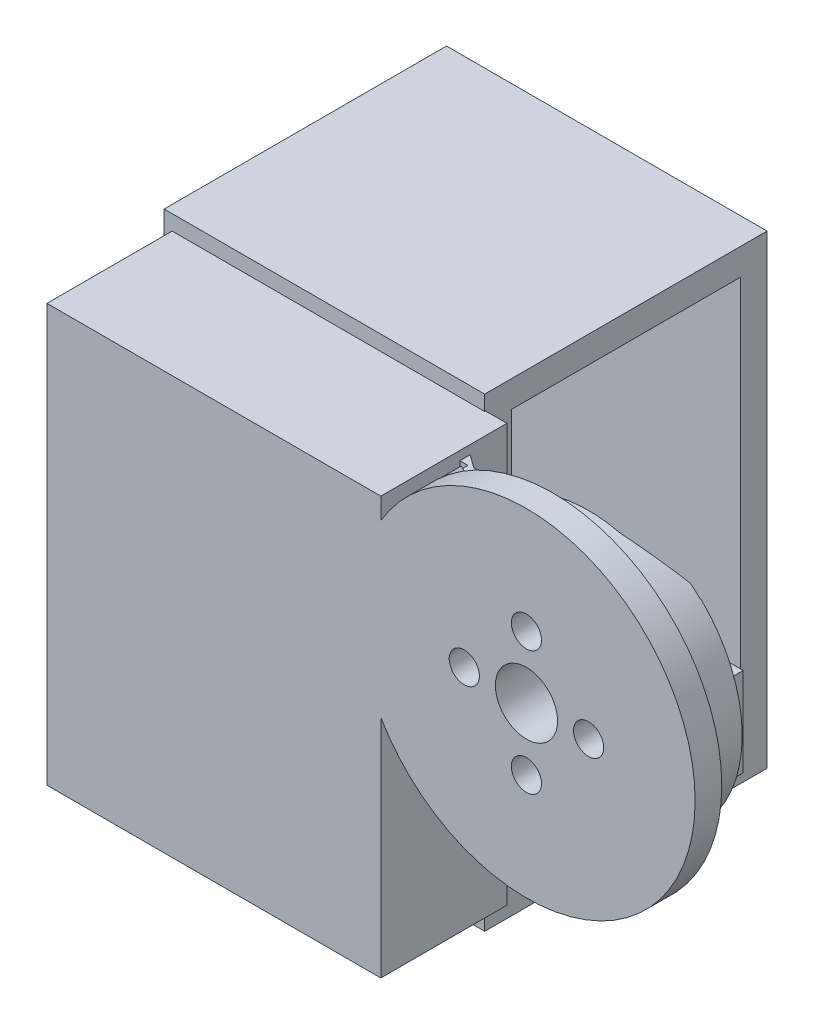
from build123d import *

# Parameters (mm, degrees)
S_CYL1_R        = 19
BOSS_1_DEPTH    = 7
BOSS_2_DEPTH    = 2.1
S_BOX3_W        = 28.2
S_BOX3_H        = 10
BOSS_3_DEPTH    = 1.5
S_BOX4_W        = 37.6
S_BOX4_H        = 47
BOSS_4_DEPTH    = 14.2
BOSS_5_DEPTH    = 23
BOSS_6_DEPTH    = 22
S_BOX7_W        = 36.1
S_BOX7_H        = 3
BOSS_7_DEPTH    = 31.8
S_BOX8_W        = 36.1
S_BOX8_H        = 3
BOSS_8_DEPTH    = 31.8
S_BOX9_W        = 36.1
S_BOX9_H        = 52.4
BOSS_9_DEPTH    = 3
S_BOX10_W       = 36.1
S_BOX10_H       = 52.4
BOSS_10_DEPTH   = 3
S_BOX11_W       = 4.6
S_BOX11_H       = 52.4
BOSS_11_DEPTH   = 31.8
S_HOLE12_R      = 10.5
HOLE_12_DEPTH   = 4.8
S_CUT13_W       = 4.75
S_CUT13_H       = 19.5
POCKET_13_DEPTH = 19.4
S_CUT14_W       = 4.75
S_CUT14_H       = 8.8
POCKET_14_DEPTH = 16.4
S_CUT15_W       = 4.75
S_CUT15_H       = 11
POCKET_15_DEPTH = 7
S_CUT16_W       = 2.9
S_CUT16_H       = 20
POCKET_16_DEPTH = 16.4
S_HOLE17_R      = 1.1
HOLE_17_DEPTH   = 4.8
S_HOLE18_R      = 2.3
HOLE_18_DEPTH   = 1.7
S_HOLE19_R      = 1.1
HOLE_19_DEPTH   = 4.8
S_HOLE20_R      = 2.3
HOLE_20_DEPTH   = 1.7
S_HOLE21_R      = 1.1
HOLE_21_DEPTH   = 4.8
S_HOLE22_R      = 2.3
HOLE_22_DEPTH   = 1.7
CUT_23_DEPTH    = 6.1
S_HOLE24_R      = 3.5
HOLE_24_DEPTH   = 10.6
S_HOLE25_R      = 1.7
HOLE_25_DEPTH   = 10.6
S_HOLE26_R      = 1.7
HOLE_26_DEPTH   = 10.6
S_HOLE27_R      = 1.7
HOLE_27_DEPTH   = 10.6
S_HOLE28_R      = 1.7
HOLE_28_DEPTH   = 10.6
S_HOLE29_R      = 3.2
HOLE_29_DEPTH   = 7.6
S_HOLE30_R      = 3.2
HOLE_30_DEPTH   = 7.6
S_HOLE31_R      = 3.2
HOLE_31_DEPTH   = 7.6
S_HOLE32_R      = 3.2
HOLE_32_DEPTH   = 7.6


with BuildPart() as part:
    # S_cyl1 → Boss_1 (new body)
    with BuildSketch(Plane.XY.offset(23)):
        Circle(S_CYL1_R)
    extrude(amount=BOSS_1_DEPTH)

    # S_prism2 → Boss_2 (add)
    with BuildSketch(Plane.XY.offset(21)):
        with BuildLine():
            Line((-15.491933385, -11), (15.491933385, -11))
            ThreePointArc((15.491933385, -11), (19, 0), (15.491933385, 11))
            Line((15.491933385, 11), (-15.491933385, 11))
            ThreePointArc((-15.491933385, 11), (-19, 0), (-15.491933385, -11))
        make_face()
    extrude(amount=BOSS_2_DEPTH)

    # S_box3 → Boss_3 (add)
    with BuildSketch(Plane.XY.offset(19.6)):
        with Locations((-0.1, 0)):
            Rectangle(S_BOX3_W, S_BOX3_H)
    extrude(amount=BOSS_3_DEPTH)

    # S_box4 → Boss_4 (add)
    with BuildSketch(Plane.XY.offset(15.8)):
        with Locations((-35.2, -11.5)):
            Rectangle(S_BOX4_W, S_BOX4_H)
    extrude(amount=BOSS_4_DEPTH)

    # S_prism5 → Boss_5 (add)
    with BuildSketch(Plane(origin=(-11.5, 0, 0), x_dir=(0, 0, -1), z_dir=(1, 0, 0))):
        Polygon((-21.05, -11), (-21.05, 12), (-23.1, 15), (-23.1, -12.5), align=None)
    extrude(amount=BOSS_5_DEPTH)

    # S_prism6 → Boss_6 (add)
    with BuildSketch(Plane(origin=(0, -11, 0), x_dir=(1, 0, 0), z_dir=(0, 1, 0))):
        Polygon((-16.45, -21.1), (-16.45, -19.9), (-14.8, -21.1), align=None)
    extrude(amount=BOSS_6_DEPTH)

    # S_box8 → Boss_8 (add)
    with BuildSketch(Plane.XY.offset(-15.9)):
        with Locations((-36.85, 12.2)):
            Rectangle(S_BOX8_W, S_BOX8_H)
    extrude(amount=BOSS_8_DEPTH)



with BuildPart() as body_2:
    # S_box7 → Boss_7 (new body)
    with BuildSketch(Plane.XY.offset(-15.9)):
        with Locations((-36.85, -37.2)):
            Rectangle(S_BOX7_W, S_BOX7_H)
    extrude(amount=BOSS_7_DEPTH)


with BuildPart() as part_1:
    add(part.part)

    add(body_2.part)  # Boss_9 merges body 2
    # S_box9 → Boss_9 (add)
    with BuildSketch(Plane.XY.offset(-15.9)):
        with Locations((-36.85, -12.5)):
            Rectangle(S_BOX9_W, S_BOX9_H)
    extrude(amount=BOSS_9_DEPTH)

    # S_box10 → Boss_10 (add)
    with BuildSketch(Plane.XY.offset(12.9)):
        with Locations((-36.85, -12.5)):
            Rectangle(S_BOX10_W, S_BOX10_H)
    extrude(amount=BOSS_10_DEPTH)

    # S_box11 → Boss_11 (add)
    with BuildSketch(Plane.XY.offset(-15.9)):
        with Locations((-52.6, -12.5)):
            Rectangle(S_BOX11_W, S_BOX11_H)
    extrude(amount=BOSS_11_DEPTH)

    # S_hole12 → Hole_12 (cut)
    with BuildSketch(Plane(origin=(-55, 0, 0), x_dir=(0, 0, -1), z_dir=(1, 0, 0))):
        with Locations(Location((0, 0, 0), (0, 0, 180))):
            Circle(S_HOLE12_R)
    extrude(amount=HOLE_12_DEPTH, mode=Mode.SUBTRACT)

    # S_cut13 → Pocket_13 (cut)
    with BuildSketch(Plane.XY.offset(-9.7)):
        with Locations((-52.625, -20.65)):
            Rectangle(S_CUT13_W, S_CUT13_H)
    extrude(amount=POCKET_13_DEPTH, mode=Mode.SUBTRACT)

    # S_cut14 → Pocket_14 (cut)
    with BuildSketch(Plane.XY.offset(-8.2)):
        with Locations((-52.625, -34.8)):
            Rectangle(S_CUT14_W, S_CUT14_H)
    extrude(amount=POCKET_14_DEPTH, mode=Mode.SUBTRACT)

    # S_cut15 → Pocket_15 (cut)
    with BuildSketch(Plane.XY.offset(-3.5)):
        with Locations((-52.625, -5.5)):
            Rectangle(S_CUT15_W, S_CUT15_H)
    extrude(amount=POCKET_15_DEPTH, mode=Mode.SUBTRACT)

    # S_cut16 → Pocket_16 (cut)
    with BuildSketch(Plane.XY.offset(-16.4)):
        with Locations((-53.65, 0)):
            Rectangle(S_CUT16_W, S_CUT16_H)
    extrude(amount=POCKET_16_DEPTH, mode=Mode.SUBTRACT)

    # S_hole17 → Hole_17 (cut)
    with BuildSketch(Plane(origin=(-55, 0, 0), x_dir=(0, 0, -1), z_dir=(1, 0, 0))):
        with Locations(Location((-10.25, -8.3, 0), (0, 0, 180))):
            Circle(S_HOLE17_R)
    extrude(amount=HOLE_17_DEPTH, mode=Mode.SUBTRACT)

    # S_hole18 → Hole_18 (cut)
    with BuildSketch(Plane(origin=(-55, 0, 0), x_dir=(0, 0, -1), z_dir=(1, 0, 0))):
        with Locations((-10.25, -8.3)):
            Circle(S_HOLE18_R)
    extrude(amount=HOLE_18_DEPTH, mode=Mode.SUBTRACT)

    # S_hole19 → Hole_19 (cut)
    with BuildSketch(Plane(origin=(-55, 0, 0), x_dir=(0, 0, -1), z_dir=(1, 0, 0))):
        with Locations(Location((10.25, -32.75, 0), (0, 0, 180))):
            Circle(S_HOLE19_R)
    extrude(amount=HOLE_19_DEPTH, mode=Mode.SUBTRACT)

    # S_hole20 → Hole_20 (cut)
    with BuildSketch(Plane(origin=(-55, 0, 0), x_dir=(0, 0, -1), z_dir=(1, 0, 0))):
        with Locations((10.25, -32.75)):
            Circle(S_HOLE20_R)
    extrude(amount=HOLE_20_DEPTH, mode=Mode.SUBTRACT)

    # S_hole21 → Hole_21 (cut)
    with BuildSketch(Plane(origin=(-55, 0, 0), x_dir=(0, 0, -1), z_dir=(1, 0, 0))):
        with Locations(Location((-10.25, -32.75, 0), (0, 0, 180))):
            Circle(S_HOLE21_R)
    extrude(amount=HOLE_21_DEPTH, mode=Mode.SUBTRACT)

    # S_hole22 → Hole_22 (cut)
    with BuildSketch(Plane(origin=(-55, 0, 0), x_dir=(0, 0, -1), z_dir=(1, 0, 0))):
        with Locations((-10.25, -32.75)):
            Circle(S_HOLE22_R)
    extrude(amount=HOLE_22_DEPTH, mode=Mode.SUBTRACT)

    # S_pcut23 → Cut_23 (cut)
    with BuildSketch(Plane.XY.offset(20.9)):
        with BuildLine():
            Line((-14.792307772, 12.858756968), (-11.547056577, 10.037703144))
            ThreePointArc((-11.547056577, 10.037703144), (11.72047998, 9.834650428), (7.880082546, -13.114659701))
            Line((7.880082546, -13.114659701), (10.094746268, -16.800479094))
            ThreePointArc((10.094746268, -16.800479094), (15.014471085, 12.59863715), (-14.792307772, 12.858756968))
        make_face()
    extrude(amount=CUT_23_DEPTH, mode=Mode.SUBTRACT)

    # S_hole24 → Hole_24 (cut)
    with BuildSketch(Plane.XY.offset(19.5)):
        Circle(S_HOLE24_R)
    extrude(amount=HOLE_24_DEPTH, mode=Mode.SUBTRACT)

    # S_hole25 → Hole_25 (cut)
    with BuildSketch(Plane.XY.offset(19.5)):
        with Locations((7, 0)):
            Circle(S_HOLE25_R)
    extrude(amount=HOLE_25_DEPTH, mode=Mode.SUBTRACT)

    # S_hole26 → Hole_26 (cut)
    with BuildSketch(Plane.XY.offset(19.5)):
        with Locations((0, 7)):
            Circle(S_HOLE26_R)
    extrude(amount=HOLE_26_DEPTH, mode=Mode.SUBTRACT)

    # S_hole27 → Hole_27 (cut)
    with BuildSketch(Plane.XY.offset(19.5)):
        with Locations((-7, 0)):
            Circle(S_HOLE27_R)
    extrude(amount=HOLE_27_DEPTH, mode=Mode.SUBTRACT)

    # S_hole28 → Hole_28 (cut)
    with BuildSketch(Plane.XY.offset(19.5)):
        with Locations((0, -7)):
            Circle(S_HOLE28_R)
    extrude(amount=HOLE_28_DEPTH, mode=Mode.SUBTRACT)

    # S_hole29 → Hole_29 (cut)
    with BuildSketch(Plane.XY.offset(19.4)):
        with Locations(Location((7, 0, 0), (0, 0, 180))):
            Circle(S_HOLE29_R)
    extrude(amount=HOLE_29_DEPTH, mode=Mode.SUBTRACT)

    # S_hole30 → Hole_30 (cut)
    with BuildSketch(Plane.XY.offset(19.4)):
        with Locations(Location((0, 7, 0), (0, 0, 218.682187453))):
            Circle(S_HOLE30_R)
    extrude(amount=HOLE_30_DEPTH, mode=Mode.SUBTRACT)

    # S_hole31 → Hole_31 (cut)
    with BuildSketch(Plane.XY.offset(19.4)):
        with Locations(Location((-7, 0, 0), (0, 0, 180))):
            Circle(S_HOLE31_R)
    extrude(amount=HOLE_31_DEPTH, mode=Mode.SUBTRACT)

    # S_hole32 → Hole_32 (cut)
    with BuildSketch(Plane.XY.offset(19.4)):
        with Locations(Location((0, -7, 0), (0, 0, 141.317812547))):
            Circle(S_HOLE32_R)
    extrude(amount=HOLE_32_DEPTH, mode=Mode.SUBTRACT)


solid = part_1.part
